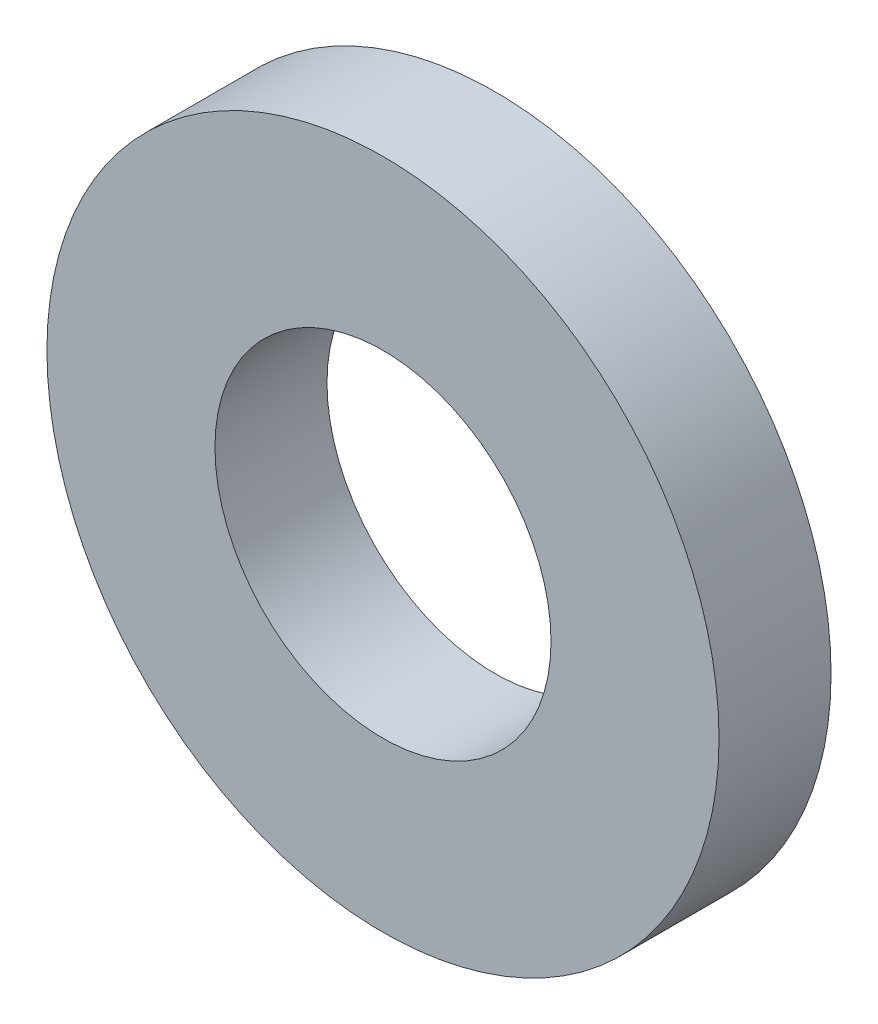
from build123d import *

# Parameters (mm, degrees)
SKETCH1_R           = 30
SKETCH1_R_2         = 15
BOSS_EXTRUDE1_DEPTH = 10


with BuildPart() as part:
    # Sketch1 → Boss-Extrude1 (new body)
    with BuildSketch(Plane.XY):
        Circle(SKETCH1_R)
        Circle(SKETCH1_R_2, mode=Mode.SUBTRACT)
    extrude(amount=BOSS_EXTRUDE1_DEPTH)


solid = part.part
